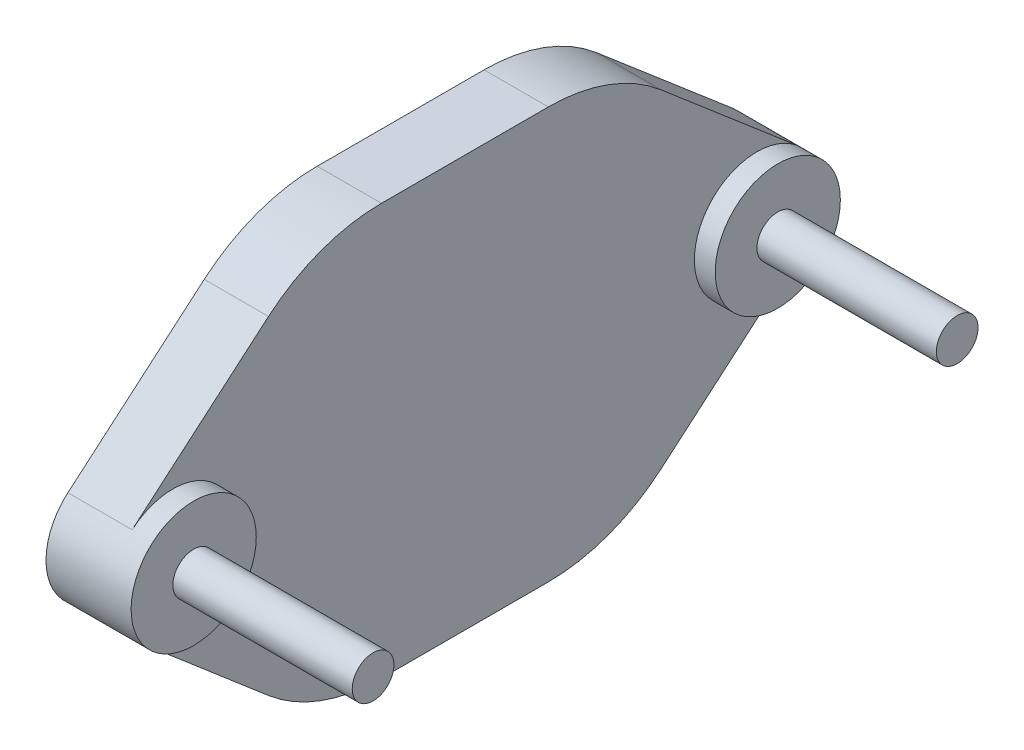
from build123d import *
from build123d.topology import SkipClean

# Parameters (mm, degrees)
SKETCH1_R           = 19.05
BOSS_EXTRUDE1_DEPTH = 19.558
SKETCH2_R           = 6.35
BOSS_EXTRUDE2_DEPTH = 60.96
SKETCH3_R           = 19.05
BOSS_EXTRUDE3_DEPTH = 6.35


with BuildPart() as part:
    # Sketch1 → Boss-Extrude1 (new body)
    with BuildSketch(Plane(origin=(0, 0, 0), x_dir=(0, 0, -1), z_dir=(1, 0, 0))):
        with BuildLine():
            Line((25.4, 62.611), (-25.4, 62.611))
            ThreePointArc((-25.4, 62.611), (-43.71389723, 59.350669702), (-59.777434529, 49.970298982))
            Line((-59.777434529, 49.970298982), (-101.281034529, 14.478))
            ThreePointArc((-101.281034529, 14.478), (-80.929937509, 17.302618411), (-69.85, 0))
            ThreePointArc((-69.85, 0), (-80.929937509, -17.302618411), (-101.281034529, -14.478))
            Line((-101.281034529, -14.478), (-59.777434529, -49.970298982))
            ThreePointArc((-59.777434529, -49.970298982), (-43.71389723, -59.350669702), (-25.4, -62.611))
            Line((-25.4, -62.611), (25.4, -62.611))
            ThreePointArc((25.4, -62.611), (43.699078076, -59.34404997), (59.737214243, -49.946847768))
            Line((59.737214243, -49.946847768), (101.269374674, -14.487973703))
            ThreePointArc((101.269374674, -14.487973703), (69.85, -7.706e-06), (101.269379322, 14.48794821))
            Line((101.269379322, 14.48794821), (59.737230268, 49.9468356))
            ThreePointArc((59.737230268, 49.9468356), (43.699087699, 59.344046737), (25.4, 62.611))
        make_face()
        with Locations((88.9, -1.0762e-05)):
            Circle(SKETCH1_R)
        with Locations((-88.9, 0)):
            Circle(SKETCH1_R)
    extrude(amount=BOSS_EXTRUDE1_DEPTH)

    # Sketch2 → Boss-Extrude2 (add)
    with BuildSketch(Plane(origin=(19.558, 0, 0), x_dir=(0, 0, -1), z_dir=(1, 0, 0))):
        with Locations(Location((-88.9, 0, 0), (0, 0, 180))):
            Circle(SKETCH2_R)
        with Locations(Location((88.9, -1.0762e-05, 0), (0, 0, 180))):
            Circle(SKETCH2_R)
    extrude(amount=BOSS_EXTRUDE2_DEPTH)

    # Sketch3 → Boss-Extrude3 (add)
    with SkipClean():  # the faces are left unmerged after this step: merging them gives an invalid solid
        with BuildSketch(Plane(origin=(19.558, 0, 0), x_dir=(0, 0, -1), z_dir=(1, 0, 0))):
            with Locations(Location((-88.9, 0, 0), (0, 0, 130.535802111))):
                Circle(SKETCH3_R)
            with Locations(Location((88.9, -1.0762e-05, 0), (0, 0, 310.489674839))):
                Circle(SKETCH3_R)
        extrude(amount=BOSS_EXTRUDE3_DEPTH)


solid = part.part
